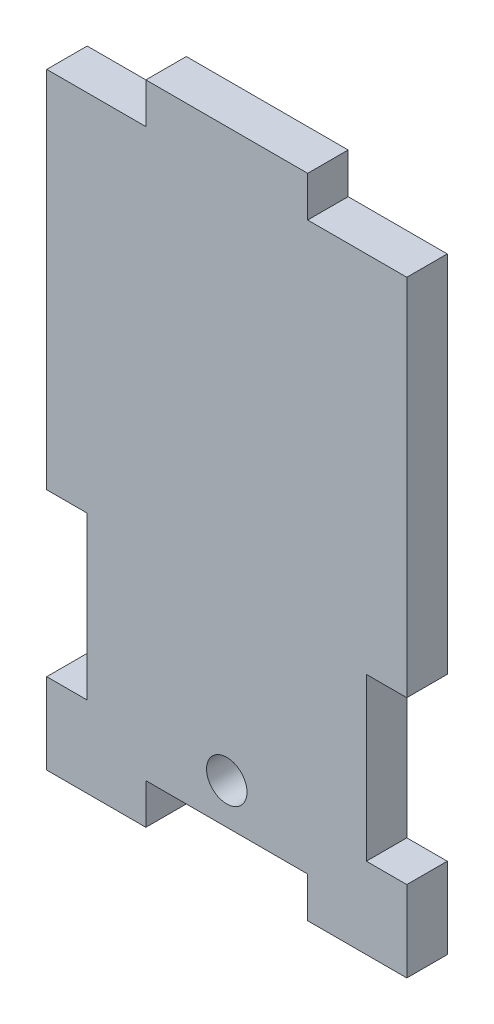
from build123d import *

# Parameters (mm, degrees)
SKETCH1_R           = 2.5
BOSS_EXTRUDE1_DEPTH = 5


with BuildPart() as part:
    # Sketch1 → Boss-Extrude1 (new body)
    with BuildSketch(Plane.XY):
        Polygon((0, 10), (0, 0), (12.25, 0), (12.25, 5), (32.25, 5), (32.25, 0), (44.5, 0), (44.5, 10), (39.5, 10), (39.5, 30), (44.5, 30), (44.5, 75), (32.25, 75), (32.25, 80), (12.25, 80), (12.25, 75), (0, 75), (0, 30), (5, 30), (5, 10), align=None)
        with Locations((22.25, 10)):
            Circle(SKETCH1_R, mode=Mode.SUBTRACT)
    extrude(amount=BOSS_EXTRUDE1_DEPTH)


solid = part.part
